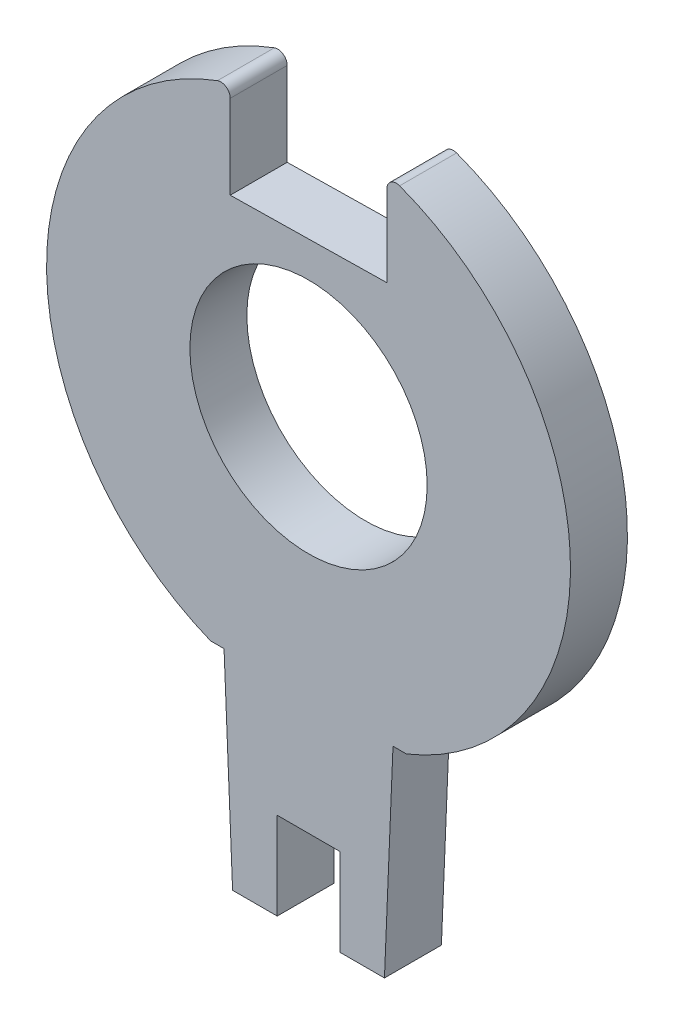
from build123d import *

# Parameters (mm, degrees)
SKETCH_1_R      = 6.25
EXTRUDE_1_DEPTH = 3


with BuildPart() as part:
    # Эскиз1 → Бобышка-Вытянуть1 (new body)
    with BuildSketch(Plane.XY):
        with BuildLine():
            Line((-5.157518783, -12.8), (-4.45, -12.8))
            Line((-4.45, -12.8), (-4, -23.6))
            Line((-4, -23.6), (-1.65, -23.6))
            Line((-1.65, -23.6), (-1.65, -19))
            Line((-1.65, -19), (1.65, -19))
            Line((1.65, -19), (1.65, -23.6))
            Line((1.65, -23.6), (4, -23.6))
            Line((4, -23.6), (4.45, -12.8))
            Line((4.45, -12.8), (5.157518783, -12.8))
            ThreePointArc((5.157518783, -12.8), (13.798660493, 0.192272192), (4.79887218, 12.938733547))
            ThreePointArc((4.79887218, 12.938733547), (4.33946199, 12.880387443), (4.125, 12.469938853))
            Line((4.125, 12.469938853), (4.125, 8.185219421))
            Line((4.125, 8.185219421), (-4.125, 8.05))
            Line((-4.125, 8.05), (-4.125, 12.469938853))
            ThreePointArc((-4.125, 12.469938853), (-4.33946199, 12.880387443), (-4.79887218, 12.938733547))
            ThreePointArc((-4.79887218, 12.938733547), (-13.798660493, 0.192272192), (-5.157518783, -12.8))
        make_face()
        Circle(SKETCH_1_R, mode=Mode.SUBTRACT)
    extrude(amount=EXTRUDE_1_DEPTH)


solid = part.part
